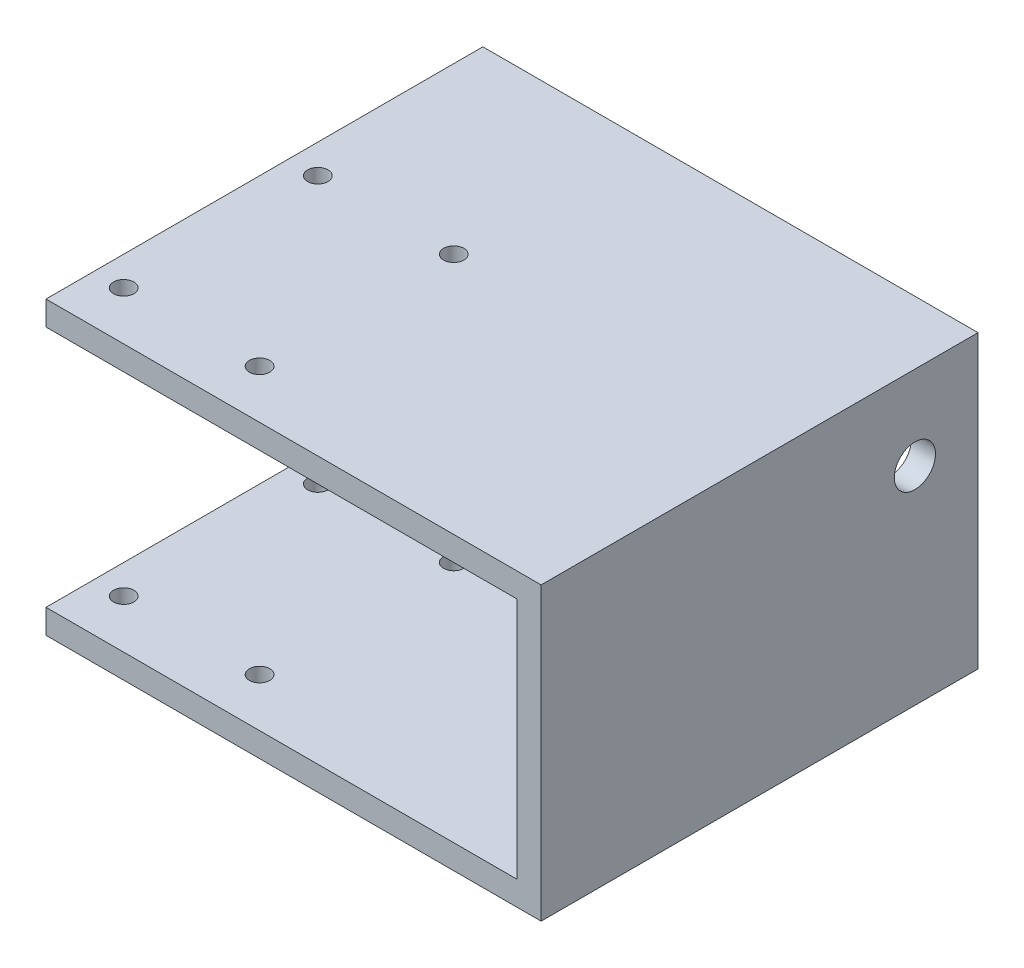
from build123d import *

# Parameters (mm, degrees)
EXTRUDE_1_DEPTH         = 90
CUT_EXTRUDE1_DEPTH      = 147.727638841
CUT_EXTRUDE1_DEPTH_BACK = 147.727638841
SKETCH1_R               = 2.1
SKETCH_2_R              = 4.25
CUT_EXTRUDE_1_DEPTH     = 144.296894593


with BuildPart() as part:
    # 草图1 → 凸台-拉伸1 (new body)
    with BuildSketch(Plane.XY):
        Polygon((0, 0), (0, 5), (102, 5), (102, -55), (0, -55), (0, -50), (97, -50), (97, 0), align=None)
    extrude(amount=EXTRUDE_1_DEPTH)

    # Sketch1 → Cut-Extrude1 (cut, two sides: drawn at the far end of the back side and taken through both)
    with BuildSketch(Plane(origin=(0, 0, 0), x_dir=(1, 0, 0), z_dir=(0, 1, 0)).offset(-CUT_EXTRUDE1_DEPTH_BACK)):
        with Locations(Location((6, -40, 0), (0, 0, 270))):
            Circle(SKETCH1_R)
        with Locations(Location((34, -40, 0), (0, 0, 270))):
            Circle(SKETCH1_R)
        with Locations(Location((34, -80, 0), (0, 0, 270))):
            Circle(SKETCH1_R)
        with Locations(Location((6, -80, 0), (0, 0, 270))):
            Circle(SKETCH1_R)
    extrude(amount=CUT_EXTRUDE1_DEPTH + CUT_EXTRUDE1_DEPTH_BACK, mode=Mode.SUBTRACT)

    # 草图2 → 切除-拉伸1 (cut, through all)
    with BuildSketch(Plane.ZY.offset(-97)):
        with Locations((13, -12.25)):
            Circle(SKETCH_2_R)
    extrude(amount=-CUT_EXTRUDE_1_DEPTH, mode=Mode.SUBTRACT)


solid = part.part
